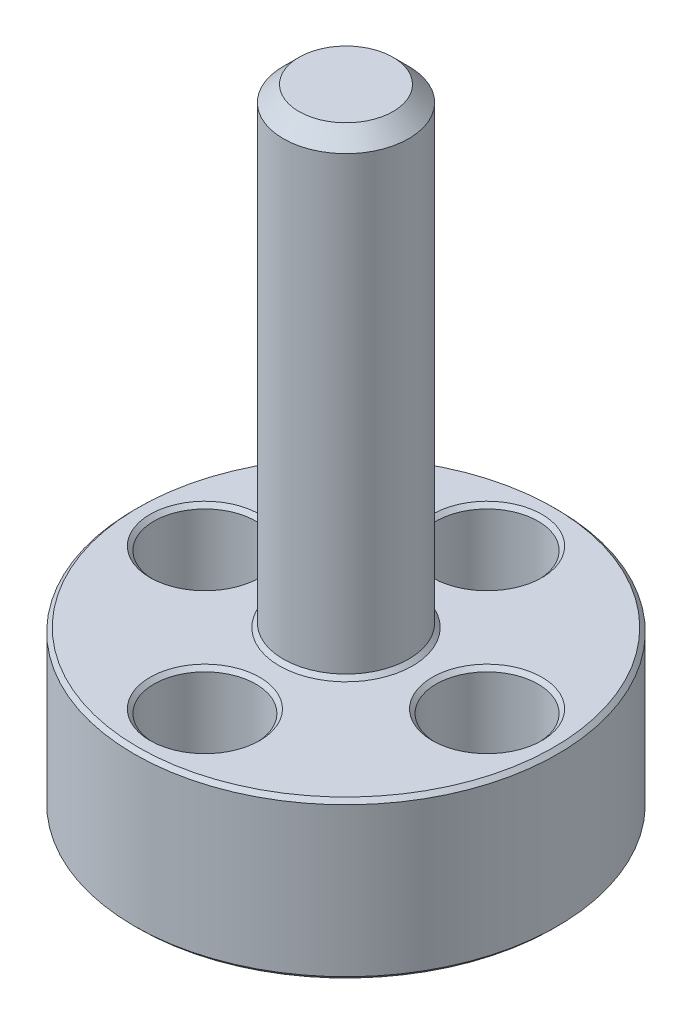
from build123d import *

# Parameters (mm, degrees)
SKETCH2_R                      = 13.5
BOSS_EXTRUDE1_DEPTH            = 10
SKETCH3_R                      = 4
BOSS_EXTRUDE2_DEPTH            = 40
CBORE_FOR_M3_SHCS1_D           = 3.2
CBORE_FOR_M3_SHCS1_CBORE_D     = 6.5
CBORE_FOR_M3_SHCS1_CBORE_DEPTH = 5
SKETCH10_R                     = 2.25
CUT_EXTRUDE3_DEPTH             = 7
CHAMFER1_SIZE                  = 0.25
CHAMFER2_SIZE                  = 1


with BuildPart() as part:
    # Sketch2 → Boss-Extrude1 (new body)
    with BuildSketch(Plane(origin=(0, 0, 0), x_dir=(1, 0, 0), z_dir=(0, 1, 0))):
        with Locations(Location((0, 0, 0), (0, 0, 270))):
            Circle(SKETCH2_R)
    extrude(amount=BOSS_EXTRUDE1_DEPTH)

    # Sketch3 → Boss-Extrude2 (add)
    with BuildSketch(Plane(origin=(0, 0, 0), x_dir=(1, 0, 0), z_dir=(0, 1, 0))):
        with Locations(Location((0, 0, 0), (0, 0, 270))):
            Circle(SKETCH3_R)
    extrude(amount=BOSS_EXTRUDE2_DEPTH)

    # CBORE for M3 SHCS1 (through all)
    with Locations(Plane(origin=(0, 10, 0), x_dir=(1, 0, 0), z_dir=(0, 1, 0))):
        with Locations((-9, 0), (9, 0), (0, 9), (0, -9)):
            CounterBoreHole(CBORE_FOR_M3_SHCS1_D / 2, CBORE_FOR_M3_SHCS1_CBORE_D / 2, CBORE_FOR_M3_SHCS1_CBORE_DEPTH)

    # Sketch10 → Cut-Extrude3 (cut)
    with BuildSketch(Plane(origin=(0, 0, 0), x_dir=(1, 0, 0), z_dir=(0, 1, 0))):
        with Locations(Location((0, 0, 0), (0, 0, 270))):
            Circle(SKETCH10_R)
    extrude(amount=CUT_EXTRUDE3_DEPTH, mode=Mode.SUBTRACT)

    # Chamfer1
    chamfer1_edges = [part.edges().sort_by_distance(p)[0] for p in [
        (-3.25, 10, 9),
        (0, 0, -13.5),
        (1.6, 0, 9),
        (5.75, 10, 0),
        (10.6, 0, 0),
        (-3.25, 10, -9),
        (1.6, 0, -9),
        (-12.25, 10, 0),
        (-7.4, 0, 0),
        (0, 10, -13.5),
        (0, 0, -2.25),
        (0, 10, -4),
    ]]
    chamfer(chamfer1_edges, length=CHAMFER1_SIZE)

    # Chamfer2
    chamfer2_edges = [part.edges().sort_by_distance(p)[0] for p in [
        (0, 40, -4),
    ]]
    chamfer(chamfer2_edges, length=CHAMFER2_SIZE)


solid = part.part
